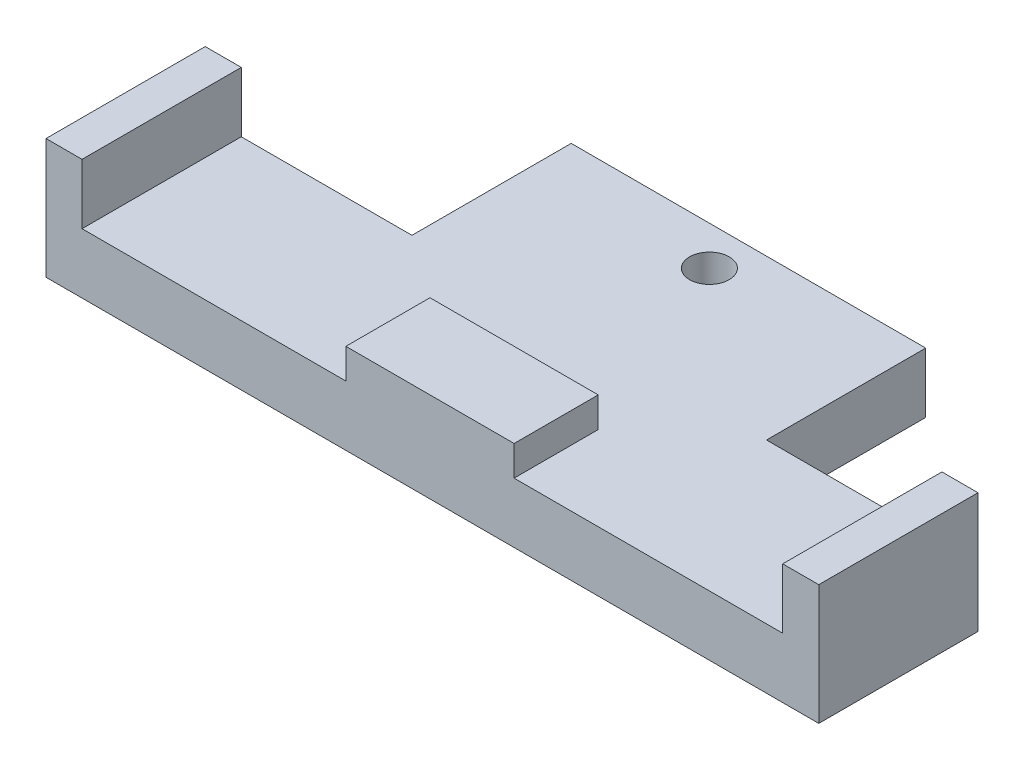
from build123d import *

# Parameters (mm, degrees)
SKETCH1_W           = 29.5
SKETCH1_H           = 6.5
SKETCH1_R           = 1.65
SKETCH1_H_2         = 20
BOSS_EXTRUDE1_DEPTH = 5
SKETCH3_W           = 14.6
SKETCH3_H           = 13.25
SKETCH3_W_2         = 14.2
BOSS_EXTRUDE2_DEPTH = 5
SKETCH5_W           = 3
SKETCH5_H           = 13.25
BOSS_EXTRUDE4_DEPTH = 5
BOSS_EXTRUDE5_DEPTH = 2.5


with BuildPart() as part:
    # Sketch1 → Boss-Extrude1 (new body)
    # profile 1 of 2: a face of its own
    with BuildSketch(Plane(origin=(0, 0, 0), x_dir=(1, 0, 0), z_dir=(0, 1, 0))):
        Rectangle(SKETCH1_W, SKETCH1_H)
        with Locations(Location((0, 0, 0), (0, 0, 270))):
            Circle(SKETCH1_R, mode=Mode.SUBTRACT)
    # profile 2 of 2: a face of its own
    with BuildSketch(Plane(origin=(0, 0, 0), x_dir=(1, 0, 0), z_dir=(0, 1, 0))):
        with Locations((0, -13.25)):
            Rectangle(SKETCH1_W, SKETCH1_H_2)
    extrude(amount=BOSS_EXTRUDE1_DEPTH)

    # Sketch3 → Boss-Extrude2 (add)
    with BuildSketch(Plane(origin=(0, 5, 0), x_dir=(1, 0, 0), z_dir=(0, 1, 0))):
        with Locations((22.05, -16.625)):
            Rectangle(SKETCH3_W, SKETCH3_H)
        with Locations((-21.85, -16.625)):
            Rectangle(SKETCH3_W_2, SKETCH3_H)
    extrude(amount=-BOSS_EXTRUDE2_DEPTH)

    # Sketch5 → Boss-Extrude4 (add, symmetric)
    with BuildSketch(Plane(origin=(0, 5, 0), x_dir=(1, 0, 0), z_dir=(0, 1, 0))):
        with Locations((-30.45, -16.625)):
            Rectangle(SKETCH5_W, SKETCH5_H)
        with Locations((30.85, -16.625)):
            Rectangle(SKETCH5_W, SKETCH5_H)
    extrude(amount=BOSS_EXTRUDE4_DEPTH, both=True)

    # Sketch6 → Boss-Extrude5 (add)
    with BuildSketch(Plane(origin=(0, 5, 0), x_dir=(1, 0, 0), z_dir=(0, 1, 0))):
        Polygon((0, -23.25), (7, -23.25), (7, -16.25), (-7, -16.25), (-7, -23.25), align=None)
    extrude(amount=BOSS_EXTRUDE5_DEPTH)


solid = part.part
